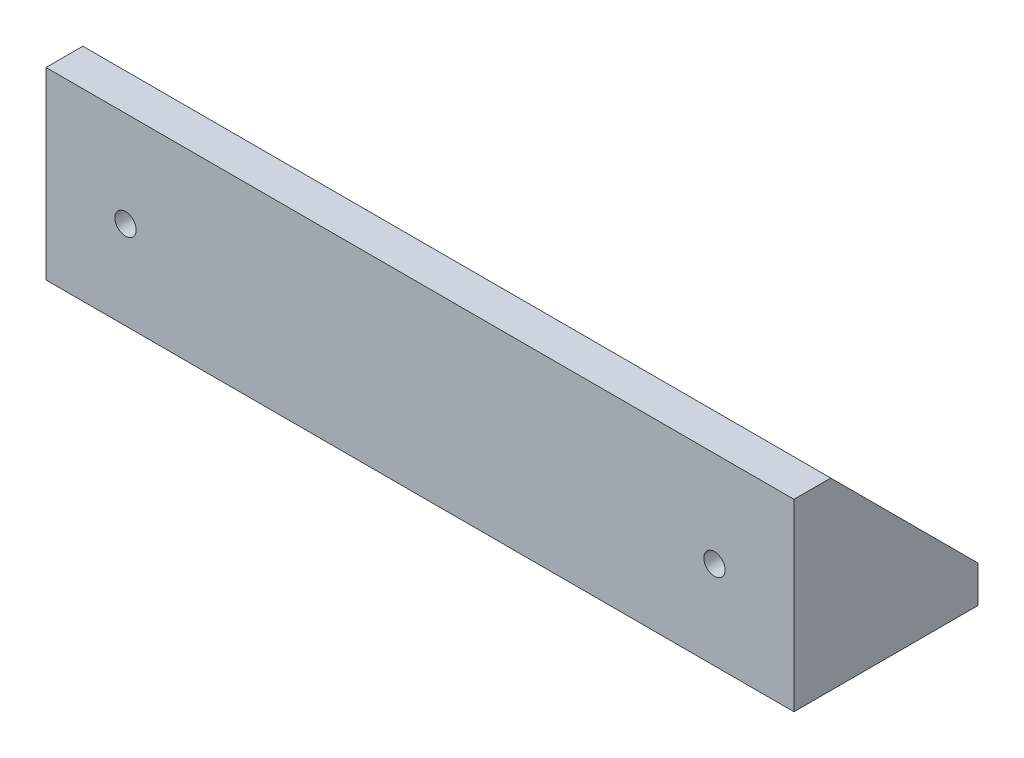
from build123d import *

# Parameters (mm, degrees)
BOSS_EXTRUDE1_START = -50.8
BOSS_EXTRUDE1_DEPTH = 101.6
HOLLOW_START        = 45
SKETCH3_W           = 20
SKETCH3_H           = 20
HOLLOW_DEPTH        = 90
BOTTOM_HOLES_D      = 2.9
FRONT_HOLES_D       = 2.9


with BuildPart() as part:
    # Sketch1 → Boss-Extrude1 (new body)
    with BuildSketch(Plane(origin=(0, 0, 0), x_dir=(0, 0, -1), z_dir=(1, 0, 0)).offset(BOSS_EXTRUDE1_START)):
        Polygon((0, 25), (0, 0), (25, 0), (25, 5), (5, 25), align=None)
    extrude(amount=BOSS_EXTRUDE1_DEPTH)

    # Sketch3 → hollow (cut)
    with BuildSketch(Plane(origin=(0, 0, 0), x_dir=(0, 0, -1), z_dir=(1, 0, 0)).offset(HOLLOW_START)):
        with Locations((15, 15)):
            Rectangle(SKETCH3_W, SKETCH3_H)
    extrude(amount=-HOLLOW_DEPTH, mode=Mode.SUBTRACT)

    # bottom holes (through all)
    with Locations(Plane(origin=(0, 0, 0), x_dir=(-1, 0, 0), z_dir=(0, -1, 0))):
        with Locations((40, 12), (-40, 12)):
            Hole(BOTTOM_HOLES_D / 2)

    # front holes (through all)
    with Locations(Plane.XY):
        with Locations((-40, 12), (40, 12)):
            Hole(FRONT_HOLES_D / 2)


solid = part.part
